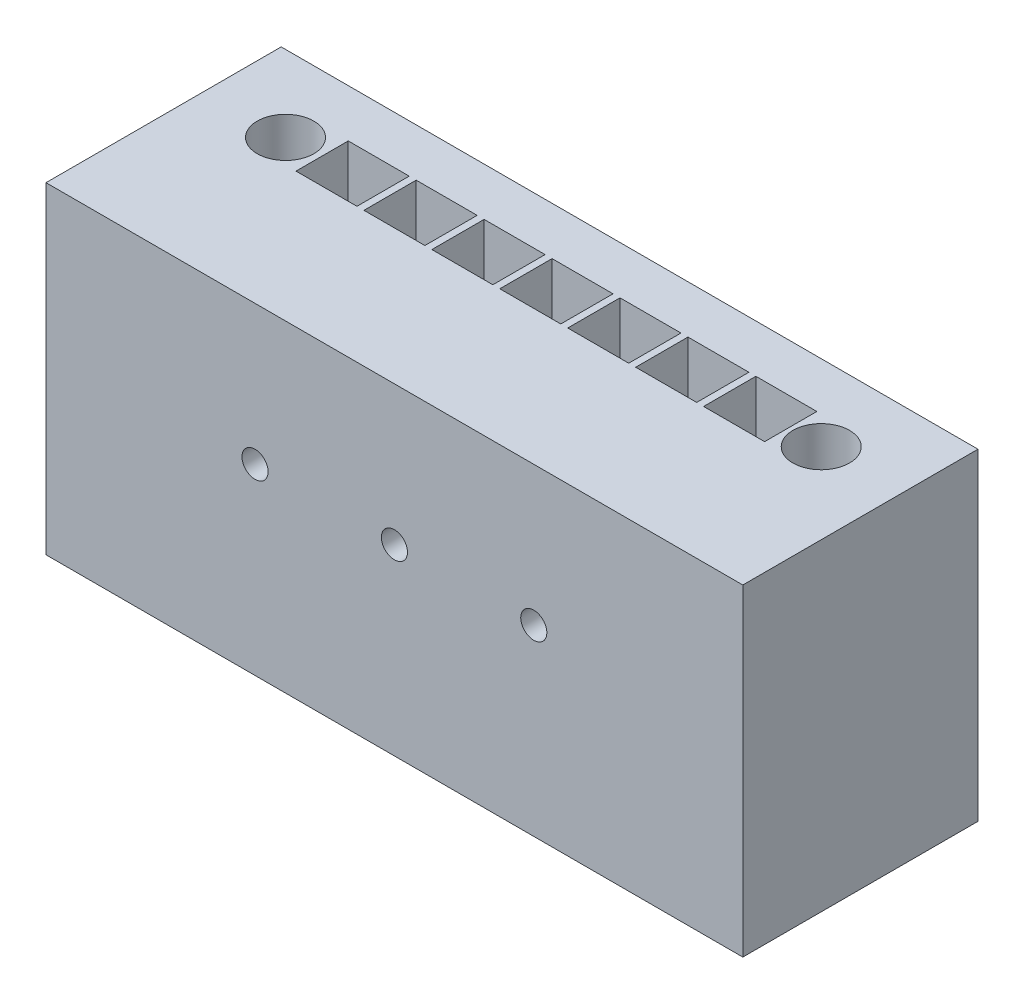
from build123d import *

# Parameters (mm, degrees)
SKETCH_1_W                     = 80
SKETCH_1_H                     = 37
EXTRUDE_1_DEPTH                = 27
SKETCH_2_W                     = 7
SKETCH_2_H                     = 6
CUT_EXTRUDE_1_DEPTH            = 61.811183182
PATTERN_LINEAR_1_COUNT         = 7
PATTERN_LINEAR_1_PITCH         = 7.8
SKETCH_3_W                     = 1.5
SKETCH_3_H                     = 15.5
HOLE_WIZARD_3_0_3_1_AT_2_COUNT = 2
HOLE_WIZARD_3_0_3_1_AT_2_PITCH = 16
HOLE_WIZARD_3_0_3_1_AT_3_COUNT = 2
HOLE_WIZARD_3_0_3_1_AT_3_PITCH = 32
HOLE_WIZARD_6_5_6_5_1_D        = 6.5
HOLE_WIZARD_3_0_3_2_D          = 3


with BuildPart() as part:
    # Эскиз1 → Бобышка-Вытянуть1 (new body)
    with BuildSketch(Plane(origin=(0, 0, 0), x_dir=(-1, 0, 0), z_dir=(0, 0, -1))):
        with Locations((0, -18.5)):
            Rectangle(SKETCH_1_W, SKETCH_1_H)
    extrude(amount=-EXTRUDE_1_DEPTH)

    # Эскиз2 → Вырез-Вытянуть1 (cut, through all)
    with BuildSketch(Plane.XZ.offset(37)):
        with Locations((-23.3, 8.5)):
            Rectangle(SKETCH_2_W, SKETCH_2_H)
    cut_extrude_1 = extrude(amount=-CUT_EXTRUDE_1_DEPTH, mode=Mode.SUBTRACT)

    # Линейный массив1: Вырез-Вытянуть1 ×7
    with Locations(*[(i * PATTERN_LINEAR_1_PITCH, 0, 0) for i in range(1, PATTERN_LINEAR_1_COUNT)]):
        add(cut_extrude_1, mode=Mode.SUBTRACT)

    # Эскиз3 → Диаметр отверстия Ø3.0 (3)1 (revolve, cut)
    with BuildSketch(Plane(origin=(16, -16, 11.5), x_dir=(0, 1, 0), z_dir=(1, 0, 0))):
        with Locations((0.75, 7.75)):
            Rectangle(SKETCH_3_W, SKETCH_3_H)
    hole_wizard_3_0_3_1 = revolve(axis=Axis((16, -16, 5.15), (0, 0, 1)), mode=Mode.SUBTRACT)

    # Диаметр отверстия Ø3.0 (3)1 at 2: Диаметр отверстия Ø3.0 (3)1 ×2
    with Locations(*[(-i * HOLE_WIZARD_3_0_3_1_AT_2_PITCH, 0, 0) for i in range(1, HOLE_WIZARD_3_0_3_1_AT_2_COUNT)]):
        add(hole_wizard_3_0_3_1, mode=Mode.SUBTRACT)

    # Диаметр отверстия Ø3.0 (3)1 at 3: Диаметр отверстия Ø3.0 (3)1 ×2
    with Locations(*[(-i * HOLE_WIZARD_3_0_3_1_AT_3_PITCH, 0, 0) for i in range(1, HOLE_WIZARD_3_0_3_1_AT_3_COUNT)]):
        add(hole_wizard_3_0_3_1, mode=Mode.SUBTRACT)

    # Диаметр отверстия Ø6.5 (6.5)1 (through all)
    with Locations(Plane(origin=(0, -37, 0), x_dir=(-1, 0, 0), z_dir=(0, -1, 0))):
        with Locations((30.75, -8.75), (-30.75, -8.75)):
            Hole(HOLE_WIZARD_6_5_6_5_1_D / 2)

    # Диаметр отверстия Ø3.0 (3)2 (through all)
    with Locations(Plane.XY.offset(5.5)):
        with Locations((16, -16), (0, -16), (-16, -16)):
            Hole(HOLE_WIZARD_3_0_3_2_D / 2)


solid = part.part
